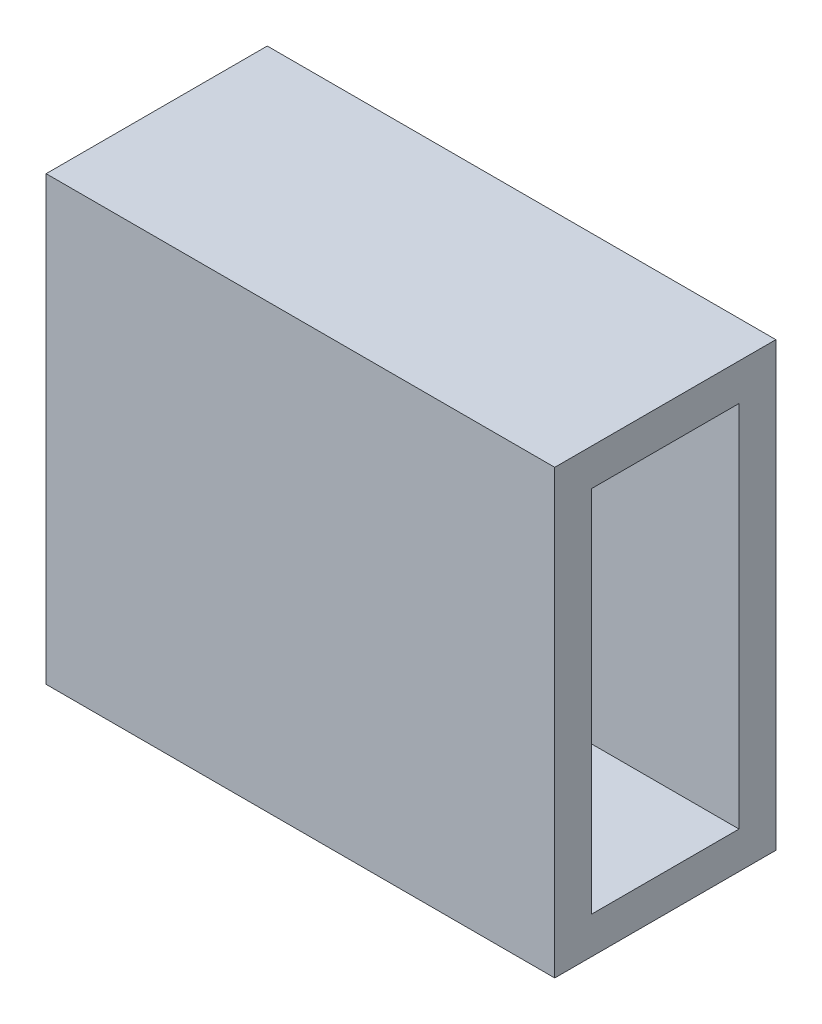
from build123d import *

# Parameters (mm, degrees)
SKETCH4_W           = 38.1
SKETCH4_H           = 76.2
SKETCH4_W_2         = 25.4
SKETCH4_H_2         = 63.5
BOSS_EXTRUDE1_DEPTH = 87.63


with BuildPart() as part:
    # Sketch4 → Boss-Extrude1 (new body)
    with BuildSketch(Plane.ZY.offset(152.4)):
        with Locations((6.35, 0)):
            Rectangle(SKETCH4_W, SKETCH4_H)
        with Locations((6.35, 0)):
            Rectangle(SKETCH4_W_2, SKETCH4_H_2, mode=Mode.SUBTRACT)
    extrude(amount=-BOSS_EXTRUDE1_DEPTH)


solid = part.part
